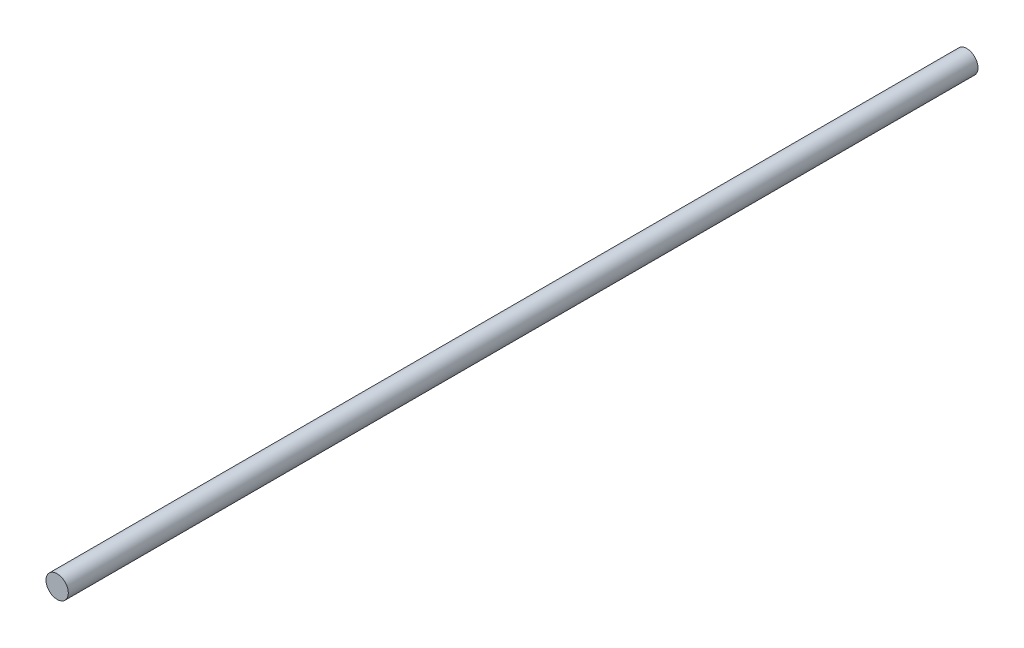
from build123d import *

# Parameters (mm, degrees)
SKETCH2_W = 325.847675392
SKETCH2_H = 4


with BuildPart() as part:
    # Sketch2 → Revolve1 (revolve)
    with BuildSketch(Plane(origin=(0, 0, 0), x_dir=(0, 0, -1), z_dir=(1, 0, 0)), mode=Mode.PRIVATE) as revolve1_sk:
        with Locations((155.123837696, 2)):
            Rectangle(SKETCH2_W, SKETCH2_H)
    revolve(revolve1_sk.sketch.rotate(Axis((0, 0, 7.8), (0, 0, -1)), 90), axis=Axis((0, 0, 7.8), (0, 0, -1)))


solid = part.part
